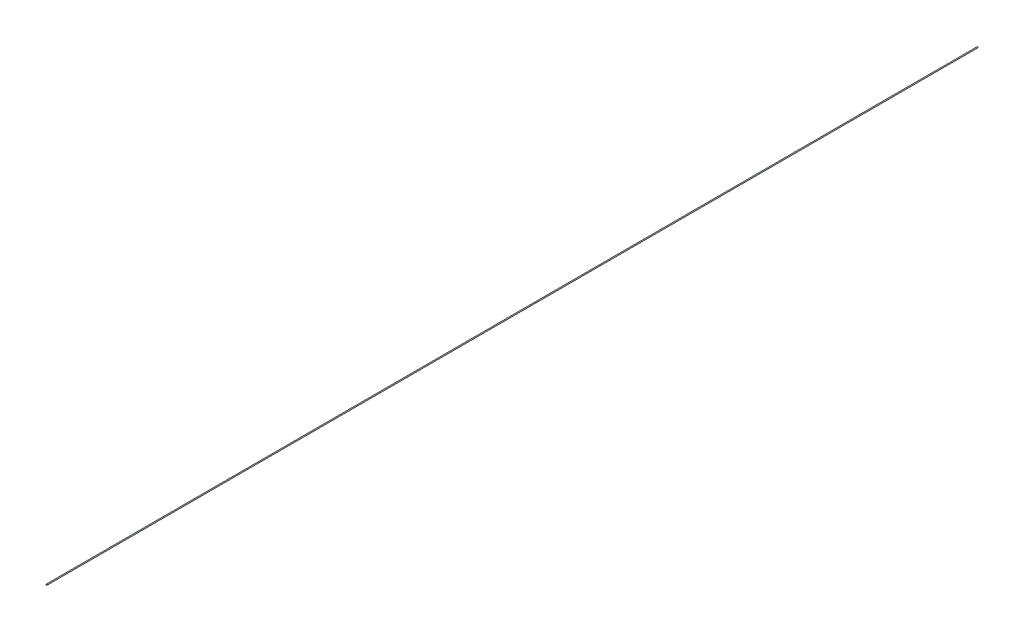
from build123d import *

# Parameters (mm, degrees)
SKETCH1_R           = 4
BOSS_EXTRUDE1_DEPTH = 7620
FILLET1_R           = 3


with BuildPart() as part:
    # Sketch1 → Boss-Extrude1 (new body)
    with BuildSketch(Plane.XY):
        Circle(SKETCH1_R)
    extrude(amount=BOSS_EXTRUDE1_DEPTH)

    # Fillet1
    fillet1_edges = [part.edges().sort_by_distance(p)[0] for p in [
        (-4, 0, 0),
        (-4, 0, 7620),
    ]]
    fillet(fillet1_edges, radius=FILLET1_R)


solid = part.part
